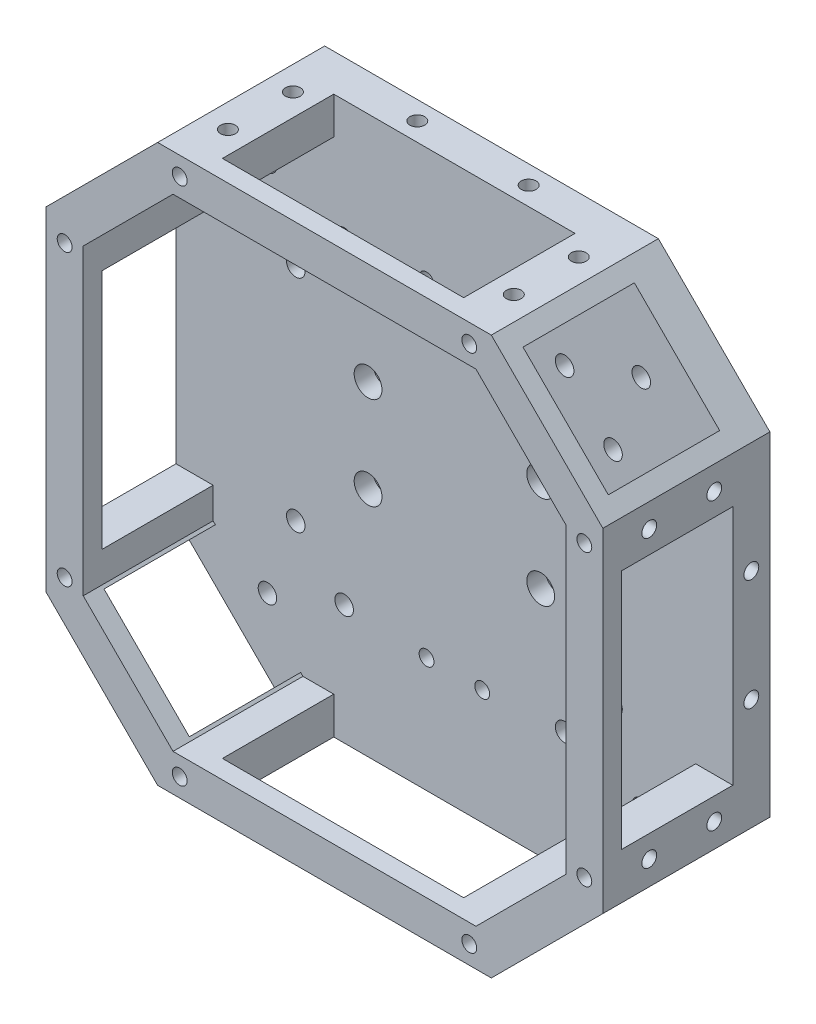
from build123d import *

# Parameters (mm, degrees)
BOSS_EXTRUDE2_DEPTH                      = 20
BOSS_EXTRUDE3_DEPTH                      = 70
CUT_EXTRUDE1_REACH                       = 349.275
SKETCH4_W                                = 130
SKETCH4_H                                = 60
CUT_EXTRUDE2_REACH                       = 349.275
SKETCH5_W                                = 130
SKETCH5_H                                = 60
CUT_EXTRUDE3_REACH                       = 394.229
SKETCH6_W                                = 65
SKETCH6_H                                = 60
CUT_EXTRUDE4_REACH                       = 394.229
SKETCH7_W                                = 65
SKETCH7_H                                = 60
SKETCH10_R                               = 5
SKETCH10_R_2                             = 4
CUT_EXTRUDE5_DEPTH                       = 224.383079037
SKETCH12_R                               = 4
CUT_EXTRUDE6_DEPTH                       = 20
CBORE_FOR_M10_HEX_HEAD_BOLT1_D           = 8
CBORE_FOR_M10_HEX_HEAD_BOLT1_CBORE_D     = 15
CBORE_FOR_M10_HEX_HEAD_BOLT1_CBORE_DEPTH = 10
SKETCH16_R                               = 4
CUT_EXTRUDE7_DEPTH                       = 10
CUT_EXTRUDE8_START                       = -10
SKETCH17_R                               = 4
CUT_EXTRUDE8_DEPTH                       = 10
SKETCH18_R                               = 4
CUT_EXTRUDE9_DEPTH                       = 10
CUT_EXTRUDE10_START                      = -10
SKETCH19_R                               = 4
CUT_EXTRUDE10_DEPTH                      = 10


with BuildPart() as part:
    # Sketch2 → Boss-Extrude2 (new body)
    with BuildSketch(Plane(origin=(0, 0, 0), x_dir=(0, 1, 0), z_dir=(0, 0, 1))):
        Polygon((-150, -89.895923599), (-89.895923599, -150), (89.895923599, -150), (150, -89.895923599), (150, 89.895923599), (89.895923599, 150), (-89.895923599, 150), (-150, 89.895923599), align=None)
    extrude(amount=BOSS_EXTRUDE2_DEPTH)

    # Sketch3 → Boss-Extrude3 (add)
    with BuildSketch(Plane.XY.offset(20)):
        Polygon((-89.895923599, -150), (89.895923599, -150), (150, -89.895923599), (150, 89.895923599), (89.895923599, 150), (-89.895923599, 150), (-150, 89.895923599), (-150, -89.895923599), align=None)
        Polygon((-81.611652352, 130), (-130, 81.611652352), (-130, -81.611652352), (-81.611652352, -130), (81.611652352, -130), (130, -81.611652352), (130, 81.611652352), (81.611652352, 130), align=None, mode=Mode.SUBTRACT)
    extrude(amount=BOSS_EXTRUDE3_DEPTH)

    # Cut-Extrude1: up to this face of the body (flat: up to its plane)
    cut_extrude1_end = Plane(part.part.faces().sort_by_distance((-150, 0, 45))[0])
    # Sketch4 → Cut-Extrude1 (cut, up to the picked face)
    with BuildSketch(Plane.YZ.offset(150), mode=Mode.PRIVATE) as cut_extrude1_sk1:
        with Locations((0, 50)):
            Rectangle(SKETCH4_W, SKETCH4_H)
    cut_extrude1_tool1 = split(extrude(cut_extrude1_sk1.sketch, amount=-CUT_EXTRUDE1_REACH, mode=Mode.PRIVATE), bisect_by=cut_extrude1_end, keep=Keep.BOTH, mode=Mode.PRIVATE)
    add(cut_extrude1_tool1.solids().sort_by(Axis((150, 0, 50), (-1, 0, 0)))[0], mode=Mode.SUBTRACT)

    # Cut-Extrude2: up to this face of the body (flat: up to its plane)
    cut_extrude2_end = Plane(part.part.faces().sort_by_distance((0, -150, 45))[0])
    # Sketch5 → Cut-Extrude2 (cut, up to the picked face)
    with BuildSketch(Plane(origin=(0, 150, 0), x_dir=(-1, 0, 0), z_dir=(0, 1, 0)), mode=Mode.PRIVATE) as cut_extrude2_sk1:
        with Locations((0, 50)):
            Rectangle(SKETCH5_W, SKETCH5_H)
    cut_extrude2_tool1 = split(extrude(cut_extrude2_sk1.sketch, amount=-CUT_EXTRUDE2_REACH, mode=Mode.PRIVATE), bisect_by=cut_extrude2_end, keep=Keep.BOTH, mode=Mode.PRIVATE)
    add(cut_extrude2_tool1.solids().sort_by(Axis((0, 150, 50), (0, -1, 0)))[0], mode=Mode.SUBTRACT)

    # Cut-Extrude3: up to this face of the body (flat: up to its plane)
    cut_extrude3_end = Plane(part.part.faces().sort_by_distance((119.9479618, 119.9479618, 45))[0])
    # Sketch6 → Cut-Extrude3 (cut, up to the picked face)
    with BuildSketch(Plane(origin=(-119.9479618, -119.9479618, 0), x_dir=(0.7071067811865475, -0.7071067811865477, 0), z_dir=(-0.7071067811865477, -0.7071067811865475, 0)), mode=Mode.PRIVATE) as cut_extrude3_sk1:
        with Locations((0, 50)):
            Rectangle(SKETCH6_W, SKETCH6_H)
    cut_extrude3_tool1 = split(extrude(cut_extrude3_sk1.sketch, amount=-CUT_EXTRUDE3_REACH, mode=Mode.PRIVATE), bisect_by=cut_extrude3_end, keep=Keep.BOTH, mode=Mode.PRIVATE)
    add(cut_extrude3_tool1.solids().sort_by(Axis((-119.947962, -119.947962, 50), (0.7071067811865477, 0.7071067811865475, 0)))[0], mode=Mode.SUBTRACT)

    # Cut-Extrude4: up to this face of the body (flat: up to its plane)
    cut_extrude4_end = Plane(part.part.faces().sort_by_distance((119.9479618, -119.9479618, 45))[0])
    # Sketch7 → Cut-Extrude4 (cut, up to the picked face)
    with BuildSketch(Plane(origin=(-119.9479618, 119.9479618, 0), x_dir=(-0.7071067811865498, -0.7071067811865454, 0), z_dir=(-0.7071067811865454, 0.7071067811865498, 0)), mode=Mode.PRIVATE) as cut_extrude4_sk1:
        with Locations((0, 50)):
            Rectangle(SKETCH7_W, SKETCH7_H)
    cut_extrude4_tool1 = split(extrude(cut_extrude4_sk1.sketch, amount=-CUT_EXTRUDE4_REACH, mode=Mode.PRIVATE), bisect_by=cut_extrude4_end, keep=Keep.BOTH, mode=Mode.PRIVATE)
    add(cut_extrude4_tool1.solids().sort_by(Axis((-119.947962, 119.947962, 50), (0.7071067811865454, -0.7071067811865498, 0)))[0], mode=Mode.SUBTRACT)

    # Sketch10 → Cut-Extrude5 (cut, through all)
    with BuildSketch(Plane.XY.offset(20)):
        with Locations((-100.72, -100.72)):
            Circle(SKETCH10_R)
        with Locations((-100.72, 100.7)):
            Circle(SKETCH10_R)
        with Locations((100.7, -100.72)):
            Circle(SKETCH10_R)
        with Locations((100.7, 100.7)):
            Circle(SKETCH10_R)
        with Locations((-59.39, -85.48)):
            Circle(SKETCH10_R)
        with Locations((-85.48, -59.39)):
            Circle(SKETCH10_R)
        with Locations(Location((59.39, -85.48, 0), (0, 0, 180))):
            Circle(SKETCH10_R)
        with Locations(Location((85.48, -59.39, 0), (0, 0, 180))):
            Circle(SKETCH10_R)
        with Locations((85.48, 59.39)):
            Circle(SKETCH10_R)
        with Locations((59.39, 85.48)):
            Circle(SKETCH10_R)
        with Locations(Location((-59.39, 85.48, 0), (0, 0, 180))):
            Circle(SKETCH10_R)
        with Locations(Location((-85.48, 59.39, 0), (0, 0, 180))):
            Circle(SKETCH10_R)
        with Locations((14.99, -88.01)):
            Circle(SKETCH10_R_2)
        with Locations((-15.01, -88.01)):
            Circle(SKETCH10_R_2)
        with Locations(Location((14.99, 88.01, 0), (0, 0, 180))):
            Circle(SKETCH10_R_2)
        with Locations(Location((-15.01, 88.01, 0), (0, 0, 180))):
            Circle(SKETCH10_R_2)
    extrude(amount=-CUT_EXTRUDE5_DEPTH, mode=Mode.SUBTRACT)

    # Sketch12 → Cut-Extrude6 (cut)
    with BuildSketch(Plane.XY.offset(90)):
        with Locations((140.01, 78.01)):
            Circle(SKETCH12_R)
        with Locations((140.01, -78.01)):
            Circle(SKETCH12_R)
        with Locations((78.01, -140.01)):
            Circle(SKETCH12_R)
        with Locations((-78.01, -140.01)):
            Circle(SKETCH12_R)
        with Locations((-140.01, -78.01)):
            Circle(SKETCH12_R)
        with Locations((-140.01, 78.01)):
            Circle(SKETCH12_R)
        with Locations((-78.01, 140.01)):
            Circle(SKETCH12_R)
        with Locations((78.01, 140.01)):
            Circle(SKETCH12_R)
    extrude(amount=-CUT_EXTRUDE6_DEPTH, mode=Mode.SUBTRACT)

    # CBORE for M10 Hex Head Bolt1 (through all)
    with Locations(Plane.XY.offset(20)):
        with Locations((-46.51, 24.99), (46.49, 24.99), (46.49, -25.01), (-46.51, -25.01)):
            CounterBoreHole(CBORE_FOR_M10_HEX_HEAD_BOLT1_D / 2, CBORE_FOR_M10_HEX_HEAD_BOLT1_CBORE_D / 2, CBORE_FOR_M10_HEX_HEAD_BOLT1_CBORE_DEPTH)

    # Sketch16 → Cut-Extrude7 (cut)
    with BuildSketch(Plane.XZ.offset(150)):
        with Locations((-77, 65)):
            Circle(SKETCH16_R)
        with Locations((-77, 30)):
            Circle(SKETCH16_R)
        with Locations((-30, 10)):
            Circle(SKETCH16_R)
        with Locations((30, 10)):
            Circle(SKETCH16_R)
        with Locations((77, 30)):
            Circle(SKETCH16_R)
        with Locations((77, 65)):
            Circle(SKETCH16_R)
    extrude(amount=-CUT_EXTRUDE7_DEPTH, mode=Mode.SUBTRACT)

    # Sketch17 → Cut-Extrude8 (cut)
    with BuildSketch(Plane(origin=(0, 150, 0), x_dir=(-1, 0, 0), z_dir=(0, 1, 0)).offset(CUT_EXTRUDE8_START)):
        with Locations(Location((-77, 65, 0), (0, 0, 180))):
            Circle(SKETCH17_R)
        with Locations(Location((-77, 30, 0), (0, 0, 180))):
            Circle(SKETCH17_R)
        with Locations(Location((-30, 10, 0), (0, 0, 180))):
            Circle(SKETCH17_R)
        with Locations(Location((30, 10, 0), (0, 0, 180))):
            Circle(SKETCH17_R)
        with Locations(Location((77, 30, 0), (0, 0, 180))):
            Circle(SKETCH17_R)
        with Locations(Location((77, 65, 0), (0, 0, 180))):
            Circle(SKETCH17_R)
    extrude(amount=CUT_EXTRUDE8_DEPTH, mode=Mode.SUBTRACT)

    # Sketch18 → Cut-Extrude9 (cut)
    with BuildSketch(Plane.YZ.offset(150)):
        with Locations((-77, 65)):
            Circle(SKETCH18_R)
        with Locations((-77, 30)):
            Circle(SKETCH18_R)
        with Locations((-30, 10)):
            Circle(SKETCH18_R)
        with Locations((30, 10)):
            Circle(SKETCH18_R)
        with Locations((77, 30)):
            Circle(SKETCH18_R)
        with Locations((77, 65)):
            Circle(SKETCH18_R)
    extrude(amount=-CUT_EXTRUDE9_DEPTH, mode=Mode.SUBTRACT)

    # Sketch19 → Cut-Extrude10 (cut)
    with BuildSketch(Plane(origin=(-150, 0, 0), x_dir=(0, -1, 0), z_dir=(-1, 0, 0)).offset(CUT_EXTRUDE10_START)):
        with Locations(Location((-77, 65, 0), (0, 0, 180))):
            Circle(SKETCH19_R)
        with Locations(Location((-77, 30, 0), (0, 0, 180))):
            Circle(SKETCH19_R)
        with Locations(Location((-30, 10, 0), (0, 0, 180))):
            Circle(SKETCH19_R)
        with Locations(Location((30, 10, 0), (0, 0, 180))):
            Circle(SKETCH19_R)
        with Locations(Location((77, 30, 0), (0, 0, 180))):
            Circle(SKETCH19_R)
        with Locations(Location((77, 65, 0), (0, 0, 180))):
            Circle(SKETCH19_R)
    extrude(amount=CUT_EXTRUDE10_DEPTH, mode=Mode.SUBTRACT)


solid = part.part
